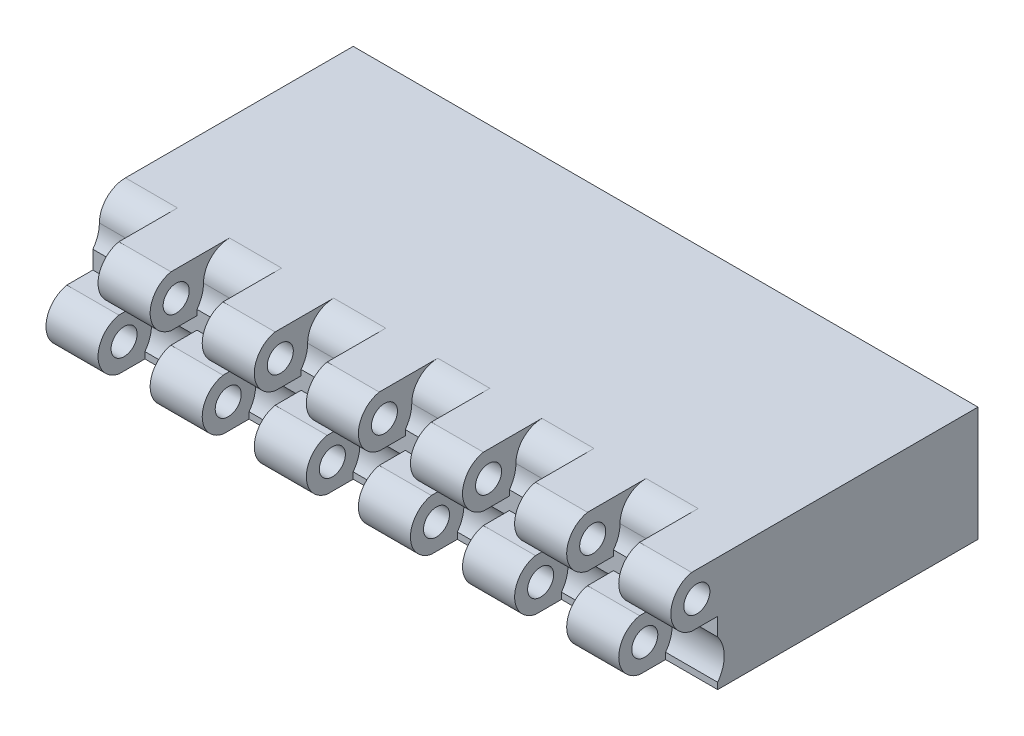
from build123d import *

# Parameters (mm, degrees)
SKETCH1_W           = 50
SKETCH1_H           = 22
BOSS_EXTRUDE1_DEPTH = 60
CUT_EXTRUDE2_REACH  = 125.069
CUT_EXTRUDE3_REACH  = 125.069
SKETCH6_R           = 6.26
FILLET1_R           = 5
SKETCH2_R           = 2.5
BOSS_EXTRUDE2_DEPTH = 10
LPATTERN1_COUNT     = 6
LPATTERN1_PITCH     = 20
SKETCH3_R           = 2.5
BOSS_EXTRUDE3_DEPTH = 10
LPATTERN2_COUNT     = 6
LPATTERN2_PITCH     = 20
SKETCH4_R           = 7
CUT_EXTRUDE1_DEPTH  = 30


with BuildPart() as part:
    # Sketch1 → Boss-Extrude1 (new, symmetric)
    with BuildSketch(Plane(origin=(0, 0, 0), x_dir=(0, 0, -1), z_dir=(1, 0, 0))):
        Rectangle(SKETCH1_W, SKETCH1_H)
    extrude(amount=BOSS_EXTRUDE1_DEPTH, both=True)

    # Sketch5 → Cut-Extrude2 (cut, up to next)
    with BuildSketch(Plane(origin=(60, 0, 0), x_dir=(0, 0, -1), z_dir=(1, 0, 0)), mode=Mode.PRIVATE) as cut_extrude2_sk1:
        with BuildLine():
            Line((-26.243342576, 11), (-23.75, 11))
            Line((-23.75, 11), (-23.75, 6.005))
            ThreePointArc((-23.75, 6.005), (-35.592030441, 3.213639122), (-26.243342576, 11))
        make_face()
    cut_extrude2_tool1 = extrude(cut_extrude2_sk1.sketch, amount=-CUT_EXTRUDE2_REACH, mode=Mode.PRIVATE) & part.part
    add(cut_extrude2_tool1.solids().sort_by_distance((60, 6.117758, 29.835764))[0], mode=Mode.SUBTRACT)

    # Sketch6 → Cut-Extrude3 (cut, up to next)
    with BuildSketch(Plane.ZY.offset(60), mode=Mode.PRIVATE) as cut_extrude3_sk1:
        with Locations((30, -6.005)):
            Circle(SKETCH6_R)
    cut_extrude3_tool1 = extrude(cut_extrude3_sk1.sketch, amount=-CUT_EXTRUDE3_REACH, mode=Mode.PRIVATE) & part.part
    add(cut_extrude3_tool1.solids().sort_by_distance((-60, -6.005, 30))[0], mode=Mode.SUBTRACT)

    # Fillet1
    fillet1_edges = [part.edges().sort_by_distance(p)[0] for p in [
        (0, 11, 23.75),
    ]]
    fillet(fillet1_edges, radius=FILLET1_R)

    # Sketch2 → Boss-Extrude2 (add)
    with BuildSketch(Plane(origin=(60, 0, 0), x_dir=(0, 0, -1), z_dir=(1, 0, 0))):
        with BuildLine():
            Line((-30, 1.202041029), (-18.75, 1.202041029))
            Line((-18.75, 1.202041029), (-18.75, 11))
            Line((-18.75, 11), (-30, 11))
            ThreePointArc((-30, 11), (-34, 6.101020514), (-30, 1.202041029))
        make_face()
        with Locations((-29, 6.101020514)):
            Circle(SKETCH2_R, mode=Mode.SUBTRACT)
    boss_extrude2 = extrude(amount=-BOSS_EXTRUDE2_DEPTH)

    # LPattern1: Boss-Extrude2 ×6
    with Locations(*[(-i * LPATTERN1_PITCH, 0, 0) for i in range(1, LPATTERN1_COUNT)]):
        add(boss_extrude2)

    # Sketch3 → Boss-Extrude3 (add)
    with BuildSketch(Plane.ZY.offset(60)):
        with BuildLine():
            Line((30, -1.202041029), (23.75, -1.202041029))
            Line((23.75, -1.202041029), (23.75, -11))
            Line((23.75, -11), (30, -11))
            ThreePointArc((30, -11), (34, -6.101020514), (30, -1.202041029))
        make_face()
        with Locations((29, -6.101020514)):
            Circle(SKETCH3_R, mode=Mode.SUBTRACT)
    boss_extrude3 = extrude(amount=-BOSS_EXTRUDE3_DEPTH)

    # LPattern2: Boss-Extrude3 ×6
    with Locations(*[(i * LPATTERN2_PITCH, 0, 0) for i in range(1, LPATTERN2_COUNT)]):
        add(boss_extrude3)

    # Sketch4 → Cut-Extrude1 (cut)
    with BuildSketch(Plane(origin=(0, 0, -25), x_dir=(-1, 0, 0), z_dir=(0, 0, -1))):
        Circle(SKETCH4_R)
    extrude(amount=-CUT_EXTRUDE1_DEPTH, mode=Mode.SUBTRACT)


solid = part.part
